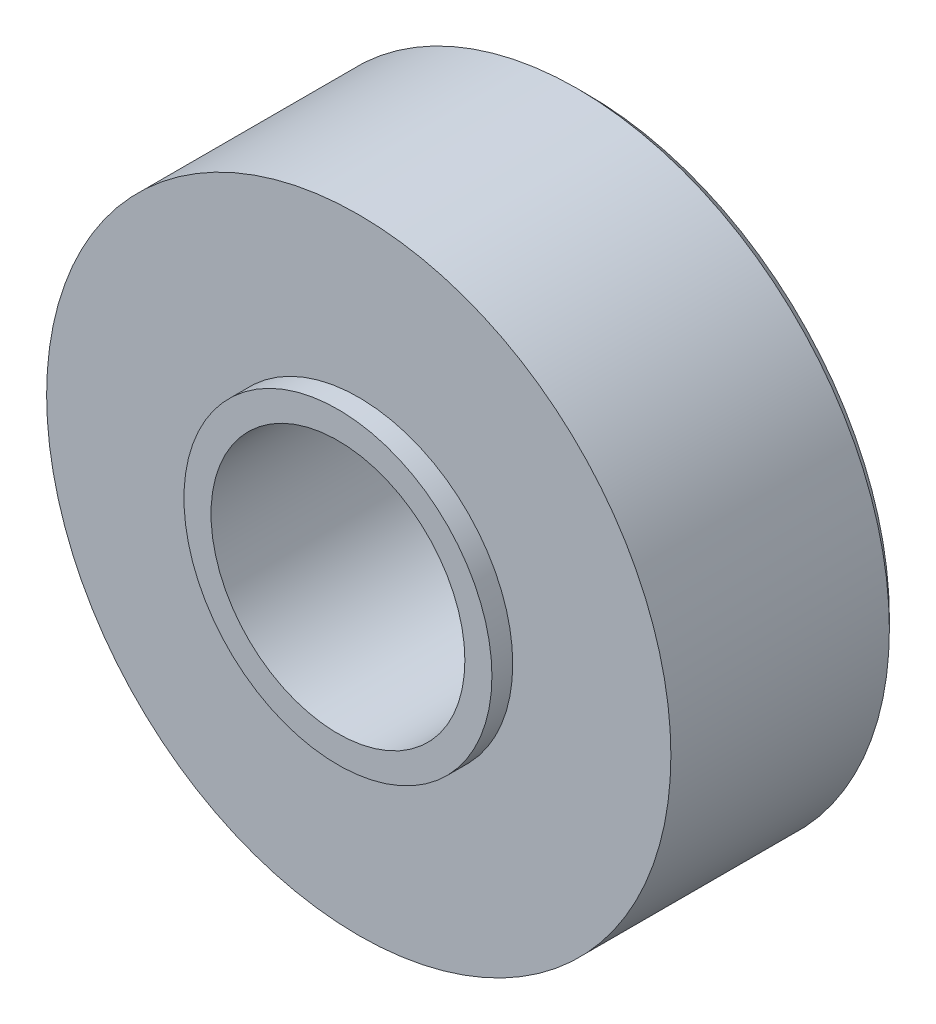
from build123d import *

# Parameters (mm, degrees)
SKETCH1_R           = 7.5
SKETCH1_R_2         = 3.05
BOSS_EXTRUDE1_DEPTH = 5.5
SKETCH2_R           = 3.7
SKETCH2_R_2         = 3.05
BOSS_EXTRUDE2_DEPTH = 0.5
CHAMFER1_SIZE       = 0.25


with BuildPart() as part:
    # Sketch1 → Boss-Extrude1 (new body)
    with BuildSketch(Plane.XY):
        Circle(SKETCH1_R)
        Circle(SKETCH1_R_2, mode=Mode.SUBTRACT)
    extrude(amount=BOSS_EXTRUDE1_DEPTH)

    # Sketch2 → Boss-Extrude2 (add)
    with BuildSketch(Plane.XY.offset(5.5)):
        Circle(SKETCH2_R)
        Circle(SKETCH2_R_2, mode=Mode.SUBTRACT)
    extrude(amount=BOSS_EXTRUDE2_DEPTH)

    # Chamfer1
    chamfer1_edges = [part.edges().sort_by_distance(p)[0] for p in [
        (-7.5, 0, 0),
        (-3.05, 0, 0),
    ]]
    chamfer(chamfer1_edges, length=CHAMFER1_SIZE)


solid = part.part
